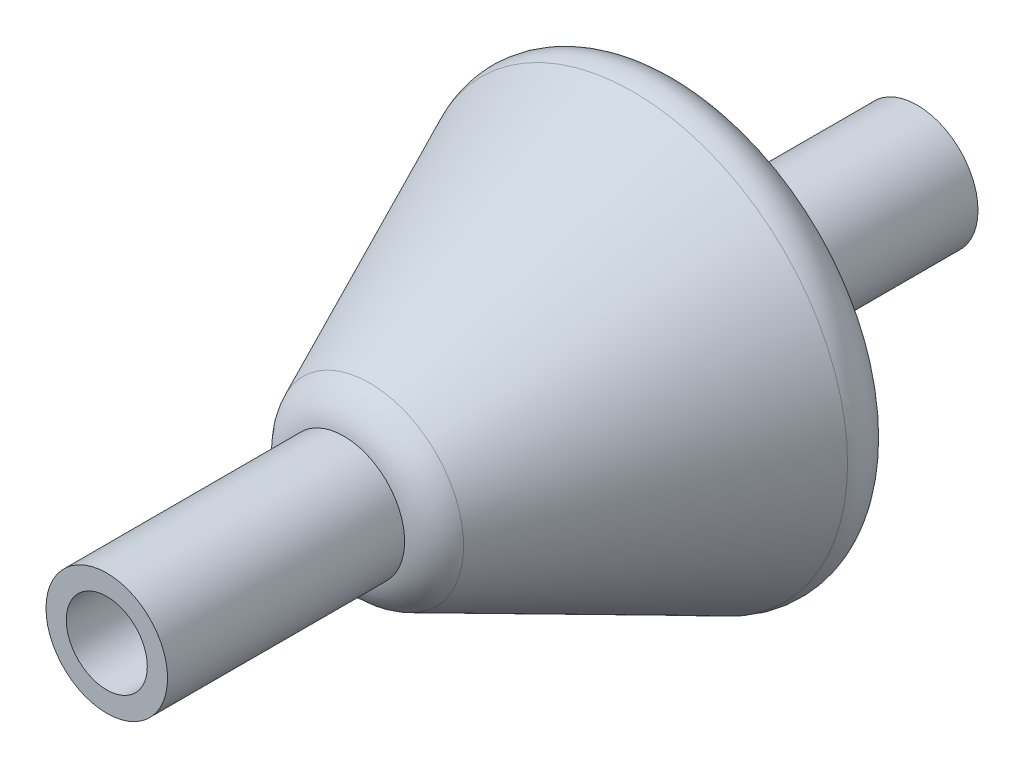
from build123d import *

# Parameters (mm, degrees)
SKETCH1_R           = 9
SKETCH1_R_2         = 6
BOSS_EXTRUDE1_DEPTH = 60


with BuildPart() as part:
    # Sketch1 → Boss-Extrude1 (new, symmetric)
    with BuildSketch(Plane.XY):
        Circle(SKETCH1_R)
        Circle(SKETCH1_R_2, mode=Mode.SUBTRACT)
    extrude(amount=BOSS_EXTRUDE1_DEPTH, both=True)

    # Sketch2 → Revolve1 (revolve)
    with BuildSketch(Plane(origin=(0, 0, 0), x_dir=(0, 0, -1), z_dir=(1, 0, 0)), mode=Mode.PRIVATE) as revolve1_sk:
        with BuildLine():
            Line((-25, 0), (-25, 7.840263865))
            ThreePointArc((-25, 7.840263865), (-23.93794832, 11.458657097), (-21.088750877, 13.929041134))
            Line((-21.088750877, 13.929041134), (17.921053029, 31.76363109))
            ThreePointArc((17.921053029, 31.76363109), (22.702338353, 31.423150362), (25, 27.21632645))
            Line((25, 27.21632645), (25, 0))
            Line((25, 0), (-25, 0))
        make_face()
    revolve(revolve1_sk.sketch.rotate(Axis((0, 0, -25), (0, 0, 1)), 90), axis=Axis((0, 0, -25), (0, 0, 1)))


solid = part.part
